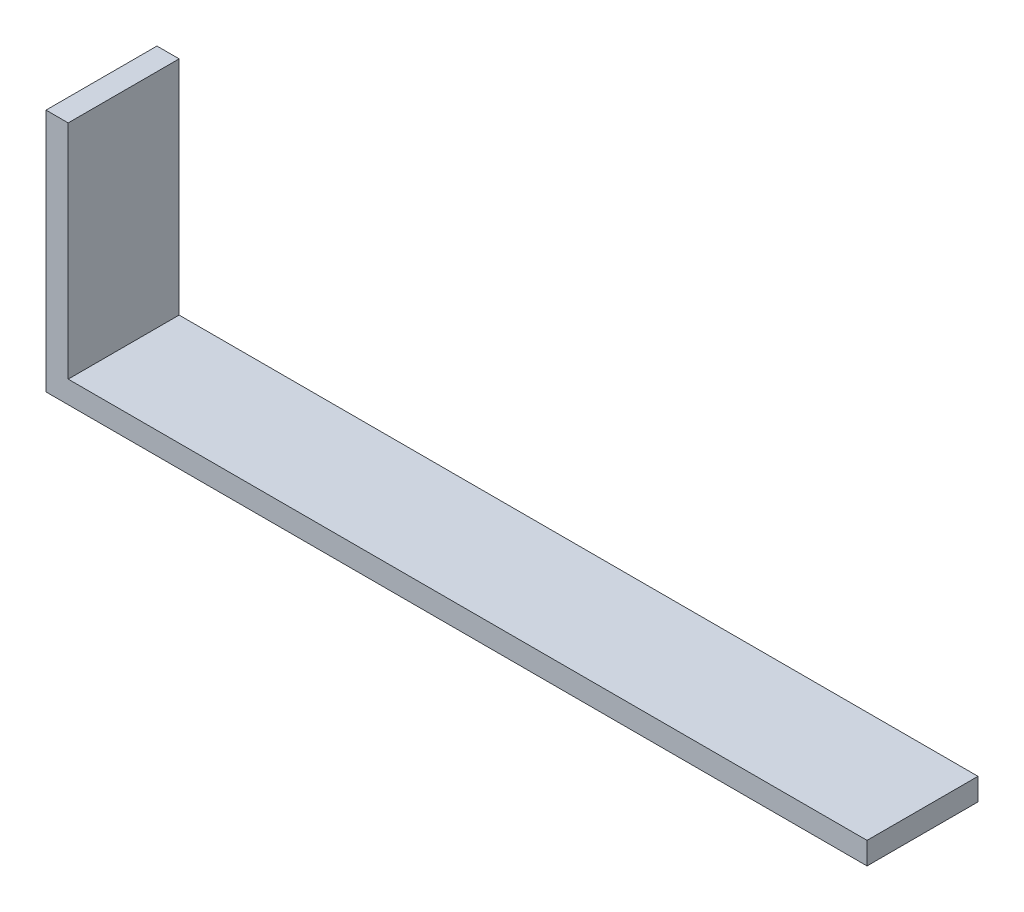
from build123d import *

# Parameters (mm, degrees)
BOSS_EXTRUDE1_DEPTH = 6.35


with BuildPart() as part:
    # Sketch1 → Boss-Extrude1 (new body)
    with BuildSketch(Plane.XY):
        Polygon((0, 5.981290323), (0, -7.988709677), (46.99, -7.988709677), (46.99, -6.718709677), (1.27, -6.718709677), (1.27, 5.981290323), align=None)
    extrude(amount=BOSS_EXTRUDE1_DEPTH)


solid = part.part
